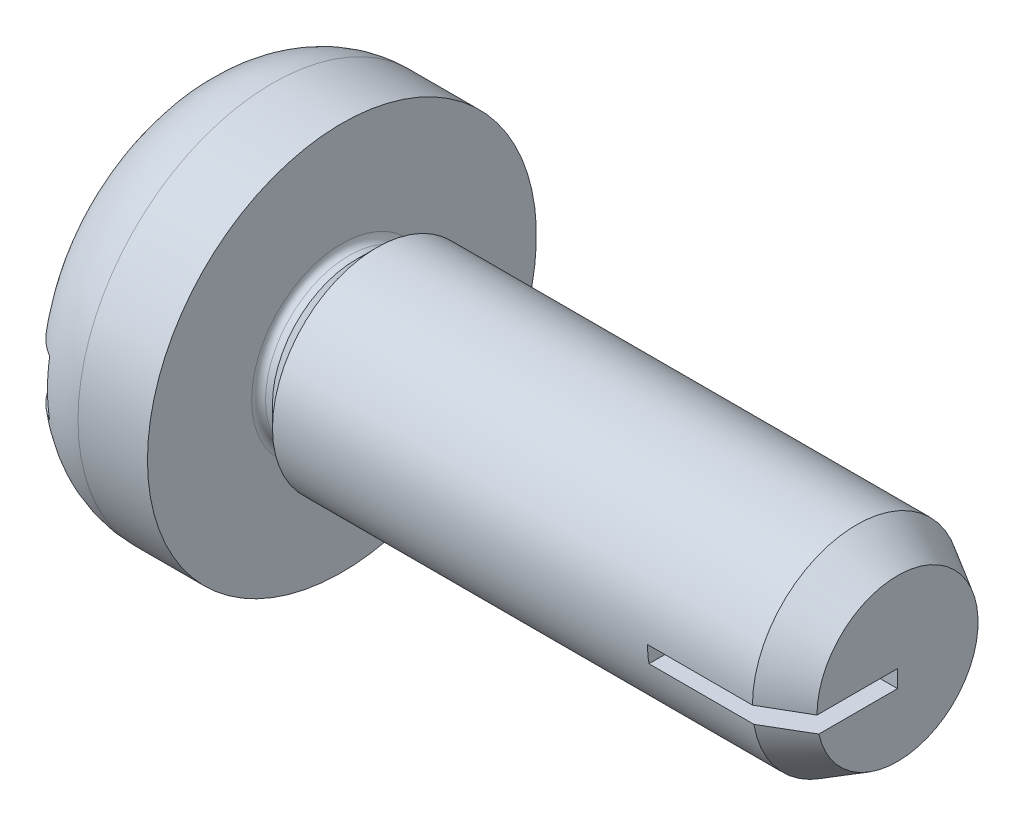
from build123d import *

# Parameters (mm, degrees)
SLOT_CUT_EXTRUDE1_DEPTH      = 11.941663519
SLOT_CUT_EXTRUDE1_DEPTH_BACK = 11.941663519
SKETCH2_W                    = 0.6
SKETCH2_H                    = 0.8
SKETCH11_W                   = 2.1
SKETCH11_H                   = 0.25
POINT_CUT_EXTRUDE8_DEPTH     = 11.941663544


with BuildPart() as part:
    # Sketch1 → base-Revolve (revolve)
    with BuildSketch(Plane.XY, mode=Mode.PRIVATE) as base_revolve_sk:
        with BuildLine():
            Line((0, 0), (0, 1.6))
            ThreePointArc((0, 1.6), (0.351471863, 2.448528137), (1.2, 2.8))
            Line((1.2, 2.8), (2.2, 2.8))
            Line((2.2, 2.8), (2.2, 1.3))
            ThreePointArc((2.2, 1.3), (2.229289322, 1.229289322), (2.3, 1.2))
            Line((2.3, 1.2), (2.4, 1.2))
            Line((2.4, 1.2), (2.7, 1.5))
            Line((2.7, 1.5), (10.2, 1.5))
            Line((10.2, 1.5), (10.2, 0))
            Line((10.2, 0), (0, 0))
        make_face()
    revolve(base_revolve_sk.sketch.rotate(Axis((0, 0, 0), (1, 0, 0)), 90), axis=Axis((0, 0, 0), (1, 0, 0)))

    # Sketch2 → slot_Cut-Extrude1 (cut, two sides: drawn at the far end of the back side and taken through both)
    with BuildSketch(Plane.XY.offset(-SLOT_CUT_EXTRUDE1_DEPTH_BACK)):
        with Locations((0.3, 0)):
            Rectangle(SKETCH2_W, SKETCH2_H)
    extrude(amount=SLOT_CUT_EXTRUDE1_DEPTH + SLOT_CUT_EXTRUDE1_DEPTH_BACK, mode=Mode.SUBTRACT)

    # Sketch8 → point_Cut-Revolve1 (revolve, cut)
    with BuildSketch(Plane.XY, mode=Mode.PRIVATE) as point_cut_revolve1_sk:
        Polygon((10.2, 0), (10.708, 0), (10.708, 2.008), (9.611102725, 2.008), (9.611102725, 1.5), (10.2, 1.16), align=None)
    revolve(point_cut_revolve1_sk.sketch.rotate(Axis((0, 0, 0), (1, 0, 0)), 90), axis=Axis((0, 0, 0), (1, 0, 0)), mode=Mode.SUBTRACT)

    # Sketch11 → point_Cut-Extrude8 (cut, through all)
    with BuildSketch(Plane.XY):
        with Locations((9.15, -0.125)):
            Rectangle(SKETCH11_W, SKETCH11_H)
    extrude(amount=POINT_CUT_EXTRUDE8_DEPTH, mode=Mode.SUBTRACT)


solid = part.part
